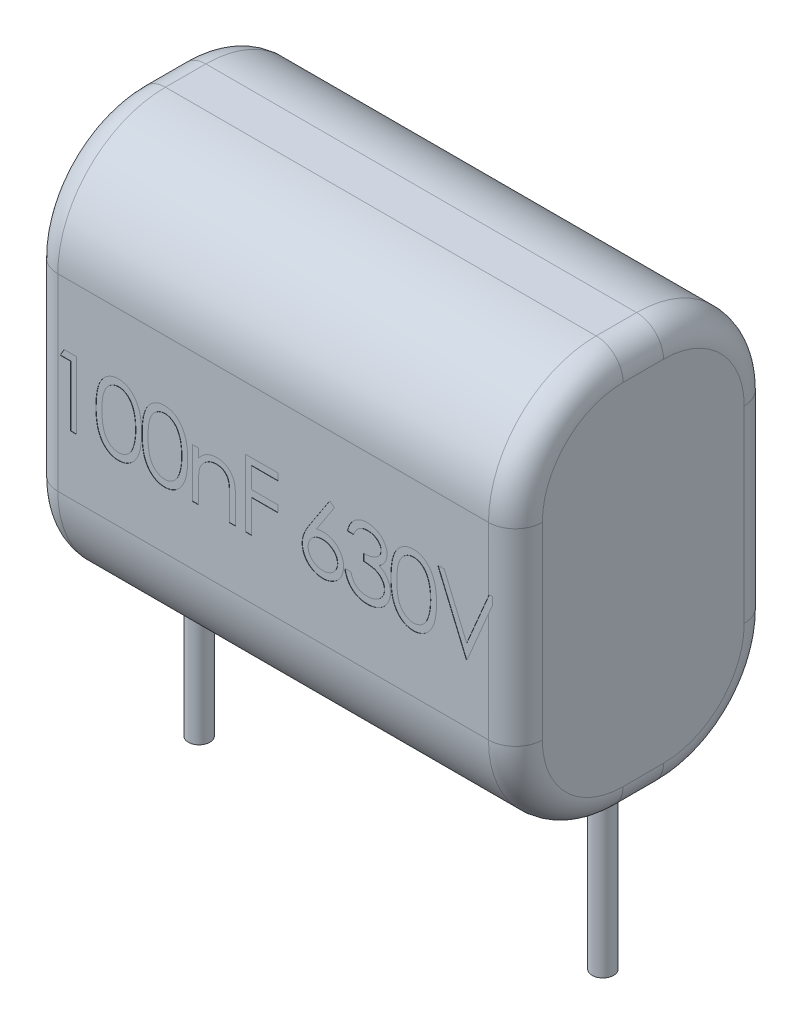
from build123d import *

# Parameters (mm, degrees)
BOSS_EXTRUDE1_DEPTH = 9
FILLET1_R           = 1
SKETCH2_R           = 0.4
BOSS_EXTRUDE2_DEPTH = 13.5
CUT_EXTRUDE1_DEPTH  = 0.01


with BuildPart() as part:
    # Sketch1 → Boss-Extrude1 (new, symmetric)
    with BuildSketch(Plane(origin=(0, 0, 0), x_dir=(0, 0, -1), z_dir=(1, 0, 0))):
        with BuildLine():
            Line((-0.75, 7.5), (0.75, 7.5))
            ThreePointArc((0.75, 7.5), (3.578427125, 6.328427125), (4.75, 3.5))
            Line((4.75, 3.5), (4.75, -3.5))
            ThreePointArc((4.75, -3.5), (3.578427125, -6.328427125), (0.75, -7.5))
            Line((0.75, -7.5), (-0.75, -7.5))
            ThreePointArc((-0.75, -7.5), (-3.578427125, -6.328427125), (-4.75, -3.5))
            Line((-4.75, -3.5), (-4.75, 3.5))
            ThreePointArc((-4.75, 3.5), (-3.578427125, 6.328427125), (-0.75, 7.5))
        make_face()
    extrude(amount=BOSS_EXTRUDE1_DEPTH, both=True)

    # Fillet1
    fillet1_edges = [part.edges().sort_by_distance(p)[0] for p in [
        (-9, 7.5, 0),
        (-9, 6.328427125, -3.578427125),
        (-9, 0, -4.75),
        (-9, -6.328427125, -3.578427125),
        (9, 6.328427125, -3.578427125),
        (9, 7.5, 0),
        (9, 6.328427125, 3.578427125),
        (9, 0, 4.75),
        (9, -6.328427125, 3.578427125),
        (9, -7.5, 0),
        (9, -6.328427125, -3.578427125),
        (-9, -7.5, 0),
        (9, 0, -4.75),
        (-9, -6.328427125, 3.578427125),
        (-9, 0, 4.75),
        (-9, 6.328427125, 3.578427125),
    ]]
    fillet(fillet1_edges, radius=FILLET1_R)

    # Sketch2 → Boss-Extrude2 (add)
    with BuildSketch(Plane(origin=(0, 0, 0), x_dir=(1, 0, 0), z_dir=(0, 1, 0))):
        with Locations(Location((7.5, 0, 0), (0, 0, 270))):
            Circle(SKETCH2_R)
        with Locations(Location((-7.5, 0, 0), (0, 0, 270))):
            Circle(SKETCH2_R)
    extrude(amount=-BOSS_EXTRUDE2_DEPTH)

    # Sketch4 → Cut-Extrude1 (cut)
    # profile 1 of 9: a face of its own
    with BuildSketch(Plane.XY.offset(4.75)):
        Polygon((-7.763521635, 1.179601095), (-7.301282051, 1.179601095), (-7.301282051, -1.320398905), (-7.525641026, -1.320398905), (-7.525641026, 0.923190838), (-7.91025641, 0.923190838), align=None)
    # profile 2 of 9: a face of its own
    with BuildSketch(Plane.XY.offset(4.75)):
        with BuildLine():
            add(Edge.make_bspline(
                [(-6.583333333, -0.071400508), (-6.583099035, -0.031330945), (-6.582643906, 0.046504758), (-6.577580748, 0.159922359), (-6.569169789, 0.266322566), (-6.557643095, 0.36571047), (-6.543615966, 0.45811173), (-6.524890618, 0.543279414), (-6.503595759, 0.621607705), (-6.478915441, 0.693352025), (-6.45106702, 0.759478956), (-6.420756834, 0.821211242), (-6.386781981, 0.87845548), (-6.351084186, 0.93212533), (-6.31221842, 0.981342255), (-6.271290713, 1.026801299), (-6.226703658, 1.067451836), (-6.179972938, 1.104484909), (-6.130675464, 1.136948817), (-6.080216416, 1.16554363), (-6.028248484, 1.189972107), (-5.974629782, 1.209179561), (-5.91984224, 1.225044452), (-5.863694335, 1.2358937), (-5.806093361, 1.242720063), (-5.767213765, 1.243372683), (-5.747495994, 1.243703659)],
                knots=[0, 0, 0, 0, 1.646270934, 3.197905019, 4.663502075, 6.030701355, 7.308322542, 8.50163776, 9.611534131, 10.641858119, 11.616356847, 12.558055219, 13.465016945, 14.349605745, 15.204443733, 16.039544428, 16.859896111, 17.680448484, 18.487036065, 19.28249412, 20.06191084, 20.843045899, 21.620316918, 22.403196591, 23.190181807, 24, 24, 24, 24], degree=3))
            add(Edge.make_bspline(
                [(-5.747495994, 1.243703659), (-5.727613509, 1.243355219), (-5.688073503, 1.242662283), (-5.629616092, 1.236002324), (-5.572509176, 1.224951522), (-5.51699622, 1.209293683), (-5.46262123, 1.1898682), (-5.40980951, 1.165520259), (-5.358233023, 1.137178211), (-5.308711389, 1.103875441), (-5.26070095, 1.066745244), (-5.215380976, 1.024771909), (-5.172747343, 0.978379252), (-5.132264982, 0.928063635), (-5.095082413, 0.872860003), (-5.059672818, 0.813728496), (-5.027978507, 0.749635021), (-4.997453739, 0.681648973), (-4.971105891, 0.607889217), (-4.947344288, 0.528771531), (-4.928145024, 0.443361397), (-4.912152687, 0.352106936), (-4.899763476, 0.25467302), (-4.89074016, 0.151268509), (-4.88597367, 0.041825372), (-4.885076027, -0.033001663), (-4.884615385, -0.071400508)],
                knots=[0, 0, 0, 0, 0.810914788, 1.612654377, 2.396697861, 3.181598691, 3.963628158, 4.749916497, 5.551656086, 6.361998678, 7.18212741, 8.025565596, 8.878627764, 9.750805457, 10.657531673, 11.591944965, 12.560506719, 13.57287815, 14.630710178, 15.753379473, 16.941251878, 18.199788006, 19.531962791, 20.947069417, 22.433333509, 24, 24, 24, 24], degree=3))
            add(Edge.make_bspline(
                [(-4.884615385, -0.071400508), (-4.885080802, -0.109631871), (-4.885987649, -0.184124122), (-4.890686725, -0.293074819), (-4.899942891, -0.395930564), (-4.911521454, -0.492938037), (-4.927557856, -0.583693479), (-4.947275832, -0.668510942), (-4.969168919, -0.747756708), (-4.996193772, -0.820781573), (-5.025772851, -0.888604232), (-5.057955134, -0.95193791), (-5.092433581, -1.011342404), (-5.129996971, -1.066342224), (-5.170035123, -1.117326979), (-5.213404972, -1.163396709), (-5.258883961, -1.205661475), (-5.307035687, -1.24326978), (-5.357329652, -1.276187498), (-5.408728993, -1.305625962), (-5.462145695, -1.329363602), (-5.516369233, -1.349745774), (-5.572175209, -1.365317525), (-5.629494059, -1.376084565), (-5.688034228, -1.383635885), (-5.727606774, -1.384211942), (-5.747495994, -1.384501469)],
                knots=[0, 0, 0, 0, 1.561518951, 3.042555995, 4.452378317, 5.7783523, 7.031515105, 8.214008947, 9.334062868, 10.386615937, 11.391082383, 12.354592575, 13.286541444, 14.194233754, 15.072674879, 15.931287219, 16.775624067, 17.606195743, 18.42308326, 19.229000347, 20.022332153, 20.807536673, 21.593273796, 22.3848459, 23.188221202, 24, 24, 24, 24], degree=3))
            add(Edge.make_bspline(
                [(-5.747495994, -1.384501469), (-5.767213218, -1.384168358), (-5.806091736, -1.383511528), (-5.863700611, -1.376716006), (-5.919616642, -1.365790646), (-5.974115752, -1.350493072), (-6.027477548, -1.331768189), (-6.078974896, -1.307372701), (-6.129180384, -1.279276937), (-6.177960067, -1.247280208), (-6.224397325, -1.210621862), (-6.268753472, -1.170075942), (-6.3099142, -1.124630648), (-6.348224268, -1.07500356), (-6.384634331, -1.021651244), (-6.418126741, -0.963845264), (-6.449105922, -0.901814828), (-6.477422701, -0.835159177), (-6.502528889, -0.762905657), (-6.524705824, -0.684227672), (-6.542215936, -0.59843079), (-6.557203761, -0.506204099), (-6.569292606, -0.407151291), (-6.577545696, -0.301218593), (-6.582646635, -0.188472015), (-6.583100257, -0.111136462), (-6.583333333, -0.071400508)],
                knots=[0, 0, 0, 0, 0.810891512, 1.598919785, 2.382837074, 3.152667961, 3.926044502, 4.706494248, 5.493654104, 6.291793342, 7.103789334, 7.925228297, 8.761435821, 9.622817696, 10.50288917, 11.416980706, 12.369136599, 13.353924996, 14.394355917, 15.514179734, 16.714354668, 17.994756427, 19.357759367, 20.818452758, 22.365282078, 24, 24, 24, 24], degree=3))
        make_face()
        with BuildLine():
            add(Edge.make_bspline(
                [(-6.358974359, -0.070398905), (-6.35888904, -0.103790833), (-6.358723452, -0.168598008), (-6.354397594, -0.262771766), (-6.348504571, -0.350607715), (-6.340903645, -0.432217384), (-6.329615824, -0.507324536), (-6.316968119, -0.576445738), (-6.301576626, -0.639215193), (-6.283365899, -0.696063629), (-6.262623687, -0.747955821), (-6.239976641, -0.796242403), (-6.215647554, -0.841493786), (-6.188419589, -0.883303506), (-6.158765972, -0.921807909), (-6.127356502, -0.957688504), (-6.093018941, -0.989686348), (-6.045516268, -1.028062673), (-5.982804501, -1.067719197), (-5.90378989, -1.102252118), (-5.822598139, -1.123953873), (-5.767490103, -1.126713698), (-5.739983974, -1.128091213)],
                knots=[0, 0, 0, 0, 1.459021318, 2.831673884, 4.118529203, 5.306027144, 6.411944654, 7.436330062, 8.375795394, 9.233974572, 10.042671642, 10.816086306, 11.563610507, 12.285937304, 12.993564865, 13.685989202, 14.367179055, 15.041617293, 16.353048772, 17.594441528, 18.799311195, 20, 20, 20, 20], degree=3))
            add(Edge.make_bspline(
                [(-5.739983974, -1.128091213), (-5.712299923, -1.126949941), (-5.656988978, -1.124669753), (-5.576179124, -1.102670655), (-5.497728931, -1.069478127), (-5.436248974, -1.030229909), (-5.389475729, -0.992852531), (-5.355963593, -0.960984925), (-5.325204987, -0.925302162), (-5.296032076, -0.886802665), (-5.269275594, -0.844750891), (-5.244944781, -0.799349051), (-5.22274239, -0.750471067), (-5.210093071, -0.716349825), (-5.203625801, -0.698904514)],
                knots=[0, 0, 0, 0, 1.353760809, 2.704726607, 4.075137775, 5.516104923, 6.260822281, 7.007110065, 7.778089737, 8.566572457, 9.372053459, 10.217411131, 11.088608312, 12, 12, 12, 12], degree=3))
            add(Edge.make_bspline(
                [(-5.203625801, -0.698904514), (-5.196088824, -0.676597557), (-5.180785529, -0.631304869), (-5.161062833, -0.561045117), (-5.145530405, -0.487328857), (-5.131556572, -0.410596631), (-5.122018675, -0.330282559), (-5.114341666, -0.246635142), (-5.109819746, -0.159591312), (-5.10925921, -0.100452032), (-5.108974359, -0.070398905)],
                knots=[0, 0, 0, 0, 0.884706709, 1.796334032, 2.740027952, 3.714592787, 4.726048262, 5.777819803, 6.87074269, 8, 8, 8, 8], degree=3))
            add(Edge.make_bspline(
                [(-5.108974359, -0.070398905), (-5.109367351, -0.040350639), (-5.110136128, 0.018430193), (-5.113074691, 0.104514608), (-5.120662958, 0.186277294), (-5.1290909, 0.264070489), (-5.141517487, 0.337463562), (-5.15491592, 0.407070923), (-5.172916786, 0.472030226), (-5.192145197, 0.533358499), (-5.214152622, 0.590358967), (-5.238378147, 0.643297385), (-5.264250832, 0.692429332), (-5.292352432, 0.737620004), (-5.322349349, 0.779071821), (-5.355033312, 0.815953674), (-5.389107864, 0.849408651), (-5.436834426, 0.8875962), (-5.499316061, 0.926533126), (-5.577062952, 0.962365811), (-5.657970555, 0.982943163), (-5.712665879, 0.985844368), (-5.739983974, 0.987293402)],
                knots=[0, 0, 0, 0, 1.31362396, 2.569729283, 3.763502607, 4.902122613, 5.988968491, 7.01645872, 7.998833611, 8.933434873, 9.825090667, 10.667526885, 11.477055099, 12.250526234, 12.991942729, 13.710640831, 14.402115721, 15.076753259, 16.378508321, 17.609869233, 18.806226677, 20, 20, 20, 20], degree=3))
            add(Edge.make_bspline(
                [(-5.739983974, 0.987293402), (-5.767634397, 0.985842369), (-5.822985616, 0.982937659), (-5.904734155, 0.962442478), (-5.983094406, 0.926718931), (-6.045410816, 0.887467236), (-6.093170664, 0.850082728), (-6.126801159, 0.817663832), (-6.158334139, 0.782202222), (-6.187382496, 0.743343711), (-6.214589127, 0.701582735), (-6.239575565, 0.65659076), (-6.262087943, 0.608139785), (-6.282862612, 0.556270903), (-6.301128889, 0.499427371), (-6.316196006, 0.436735233), (-6.330115329, 0.367833882), (-6.339969093, 0.292319947), (-6.348728918, 0.210689838), (-6.354358453, 0.122634611), (-6.358737922, 0.02830291), (-6.358893968, -0.036839346), (-6.358974359, -0.070398905)],
                knots=[0, 0, 0, 0, 1.207732386, 2.417664972, 3.655092373, 4.956220595, 5.625982001, 6.301752483, 6.994047911, 7.697131622, 8.419323945, 9.170223765, 9.943494443, 10.752040957, 11.610060368, 12.549350801, 13.567764191, 14.679664412, 15.874934091, 17.154273443, 18.533957287, 20, 20, 20, 20], degree=3))
        make_face(mode=Mode.SUBTRACT)
    # profile 3 of 9: a face of its own
    with BuildSketch(Plane.XY.offset(4.75)):
        with BuildLine():
            add(Edge.make_bspline(
                [(-4.871794872, -0.071400508), (-4.871560573, -0.031330945), (-4.871105445, 0.046504758), (-4.866042287, 0.159922359), (-4.857631328, 0.266322566), (-4.846104633, 0.36571047), (-4.832077504, 0.45811173), (-4.813352157, 0.543279414), (-4.792057298, 0.621607705), (-4.767376979, 0.693352025), (-4.739528559, 0.759478956), (-4.709218372, 0.821211242), (-4.675243519, 0.87845548), (-4.639545724, 0.93212533), (-4.600679959, 0.981342255), (-4.559752251, 1.026801299), (-4.515165197, 1.067451836), (-4.468434477, 1.104484909), (-4.419137002, 1.136948817), (-4.368677955, 1.16554363), (-4.316710022, 1.189972107), (-4.26309132, 1.209179561), (-4.208303779, 1.225044452), (-4.152155874, 1.2358937), (-4.0945549, 1.242720063), (-4.055675303, 1.243372683), (-4.035957532, 1.243703659)],
                knots=[0, 0, 0, 0, 1.646270934, 3.197905019, 4.663502075, 6.030701355, 7.308322542, 8.50163776, 9.611534131, 10.641858119, 11.616356847, 12.558055219, 13.465016945, 14.349605745, 15.204443733, 16.039544428, 16.859896111, 17.680448484, 18.487036065, 19.28249412, 20.06191084, 20.843045899, 21.620316918, 22.403196591, 23.190181807, 24, 24, 24, 24], degree=3))
            add(Edge.make_bspline(
                [(-4.035957532, 1.243703659), (-4.016075047, 1.243355219), (-3.976535041, 1.242662283), (-3.91807763, 1.236002324), (-3.860970715, 1.224951522), (-3.805457758, 1.209293683), (-3.751082768, 1.1898682), (-3.698271048, 1.165520259), (-3.646694561, 1.137178211), (-3.597172928, 1.103875441), (-3.549162488, 1.066745244), (-3.503842514, 1.024771909), (-3.461208882, 0.978379252), (-3.420726521, 0.928063635), (-3.383543951, 0.872860003), (-3.348134357, 0.813728496), (-3.316440045, 0.749635021), (-3.285915277, 0.681648973), (-3.25956743, 0.607889217), (-3.235805826, 0.528771531), (-3.216606563, 0.443361397), (-3.200614225, 0.352106936), (-3.188225014, 0.25467302), (-3.179201698, 0.151268509), (-3.174435209, 0.041825372), (-3.173537565, -0.033001663), (-3.173076923, -0.071400508)],
                knots=[0, 0, 0, 0, 0.810914788, 1.612654377, 2.396697861, 3.181598691, 3.963628158, 4.749916497, 5.551656086, 6.361998678, 7.18212741, 8.025565596, 8.878627764, 9.750805457, 10.657531673, 11.591944965, 12.560506719, 13.57287815, 14.630710178, 15.753379473, 16.941251878, 18.199788006, 19.531962791, 20.947069417, 22.433333509, 24, 24, 24, 24], degree=3))
            add(Edge.make_bspline(
                [(-3.173076923, -0.071400508), (-3.173542341, -0.109631871), (-3.174449188, -0.184124122), (-3.179148264, -0.293074819), (-3.188404429, -0.395930564), (-3.199982992, -0.492938037), (-3.216019394, -0.583693479), (-3.23573737, -0.668510942), (-3.257630458, -0.747756708), (-3.284655311, -0.820781573), (-3.31423439, -0.888604232), (-3.346416673, -0.95193791), (-3.38089512, -1.011342404), (-3.418458509, -1.066342224), (-3.458496661, -1.117326979), (-3.501866511, -1.163396709), (-3.5473455, -1.205661475), (-3.595497226, -1.24326978), (-3.645791191, -1.276187498), (-3.697190531, -1.305625962), (-3.750607234, -1.329363602), (-3.804830771, -1.349745774), (-3.860636747, -1.365317525), (-3.917955598, -1.376084565), (-3.976495766, -1.383635885), (-4.016068313, -1.384211942), (-4.035957532, -1.384501469)],
                knots=[0, 0, 0, 0, 1.561518951, 3.042555995, 4.452378317, 5.7783523, 7.031515105, 8.214008947, 9.334062868, 10.386615937, 11.391082383, 12.354592575, 13.286541444, 14.194233754, 15.072674879, 15.931287219, 16.775624067, 17.606195743, 18.42308326, 19.229000347, 20.022332153, 20.807536673, 21.593273796, 22.3848459, 23.188221202, 24, 24, 24, 24], degree=3))
            add(Edge.make_bspline(
                [(-4.035957532, -1.384501469), (-4.055674756, -1.384168358), (-4.094553274, -1.383511528), (-4.152162149, -1.376716006), (-4.20807818, -1.365790646), (-4.26257729, -1.350493072), (-4.315939087, -1.331768189), (-4.367436434, -1.307372701), (-4.417641923, -1.279276937), (-4.466421606, -1.247280208), (-4.512858864, -1.210621862), (-4.55721501, -1.170075942), (-4.598375738, -1.124630648), (-4.636685806, -1.07500356), (-4.673095869, -1.021651244), (-4.706588279, -0.963845264), (-4.73756746, -0.901814828), (-4.76588424, -0.835159177), (-4.790990428, -0.762905657), (-4.813167362, -0.684227672), (-4.830677475, -0.59843079), (-4.8456653, -0.506204099), (-4.857754145, -0.407151291), (-4.866007234, -0.301218593), (-4.871108174, -0.188472015), (-4.871561795, -0.111136462), (-4.871794872, -0.071400508)],
                knots=[0, 0, 0, 0, 0.810891512, 1.598919785, 2.382837074, 3.152667961, 3.926044502, 4.706494248, 5.493654104, 6.291793342, 7.103789334, 7.925228297, 8.761435821, 9.622817696, 10.50288917, 11.416980706, 12.369136599, 13.353924996, 14.394355917, 15.514179734, 16.714354668, 17.994756427, 19.357759367, 20.818452758, 22.365282078, 24, 24, 24, 24], degree=3))
        make_face()
        with BuildLine():
            add(Edge.make_bspline(
                [(-4.647435897, -0.070398905), (-4.647350578, -0.103790833), (-4.64718499, -0.168598008), (-4.642859132, -0.262771766), (-4.63696611, -0.350607715), (-4.629365183, -0.432217384), (-4.618077363, -0.507324536), (-4.605429657, -0.576445738), (-4.590038165, -0.639215193), (-4.571827437, -0.696063629), (-4.551085225, -0.747955821), (-4.52843818, -0.796242403), (-4.504109092, -0.841493786), (-4.476881127, -0.883303506), (-4.447227511, -0.921807909), (-4.41581804, -0.957688504), (-4.38148048, -0.989686348), (-4.333977807, -1.028062673), (-4.271266039, -1.067719197), (-4.192251428, -1.102252118), (-4.111059678, -1.123953873), (-4.055951642, -1.126713698), (-4.028445513, -1.128091213)],
                knots=[0, 0, 0, 0, 1.459021318, 2.831673884, 4.118529203, 5.306027144, 6.411944654, 7.436330062, 8.375795394, 9.233974572, 10.042671642, 10.816086306, 11.563610507, 12.285937304, 12.993564865, 13.685989202, 14.367179055, 15.041617293, 16.353048772, 17.594441528, 18.799311195, 20, 20, 20, 20], degree=3))
            add(Edge.make_bspline(
                [(-4.028445513, -1.128091213), (-4.000761462, -1.126949941), (-3.945450517, -1.124669753), (-3.864640663, -1.102670655), (-3.78619047, -1.069478127), (-3.724710513, -1.030229909), (-3.677937267, -0.992852531), (-3.644425131, -0.960984925), (-3.613666525, -0.925302162), (-3.584493615, -0.886802665), (-3.557737132, -0.844750891), (-3.53340632, -0.799349051), (-3.511203928, -0.750471067), (-3.49855461, -0.716349825), (-3.49208734, -0.698904514)],
                knots=[0, 0, 0, 0, 1.353760809, 2.704726607, 4.075137775, 5.516104923, 6.260822281, 7.007110065, 7.778089737, 8.566572457, 9.372053459, 10.217411131, 11.088608312, 12, 12, 12, 12], degree=3))
            add(Edge.make_bspline(
                [(-3.49208734, -0.698904514), (-3.484550363, -0.676597557), (-3.469247067, -0.631304869), (-3.449524371, -0.561045117), (-3.433991943, -0.487328857), (-3.420018111, -0.410596631), (-3.410480213, -0.330282559), (-3.402803204, -0.246635142), (-3.398281285, -0.159591312), (-3.397720748, -0.100452032), (-3.397435897, -0.070398905)],
                knots=[0, 0, 0, 0, 0.884706709, 1.796334032, 2.740027952, 3.714592787, 4.726048262, 5.777819803, 6.87074269, 8, 8, 8, 8], degree=3))
            add(Edge.make_bspline(
                [(-3.397435897, -0.070398905), (-3.39782889, -0.040350639), (-3.398597667, 0.018430193), (-3.401536229, 0.104514608), (-3.409124497, 0.186277294), (-3.417552439, 0.264070489), (-3.429979025, 0.337463562), (-3.443377459, 0.407070923), (-3.461378325, 0.472030226), (-3.480606735, 0.533358499), (-3.502614161, 0.590358967), (-3.526839685, 0.643297385), (-3.55271237, 0.692429332), (-3.580813971, 0.737620004), (-3.610810887, 0.779071821), (-3.643494851, 0.815953674), (-3.677569403, 0.849408651), (-3.725295964, 0.8875962), (-3.7877776, 0.926533126), (-3.865524491, 0.962365811), (-3.946432094, 0.982943163), (-4.001127418, 0.985844368), (-4.028445513, 0.987293402)],
                knots=[0, 0, 0, 0, 1.31362396, 2.569729283, 3.763502607, 4.902122613, 5.988968491, 7.01645872, 7.998833611, 8.933434873, 9.825090667, 10.667526885, 11.477055099, 12.250526234, 12.991942729, 13.710640831, 14.402115721, 15.076753259, 16.378508321, 17.609869233, 18.806226677, 20, 20, 20, 20], degree=3))
            add(Edge.make_bspline(
                [(-4.028445513, 0.987293402), (-4.056095936, 0.985842369), (-4.111447154, 0.982937659), (-4.193195693, 0.962442478), (-4.271555944, 0.926718931), (-4.333872355, 0.887467236), (-4.381632202, 0.850082728), (-4.415262698, 0.817663832), (-4.446795678, 0.782202222), (-4.475844035, 0.743343711), (-4.503050666, 0.701582735), (-4.528037103, 0.65659076), (-4.550549482, 0.608139785), (-4.57132415, 0.556270903), (-4.589590428, 0.499427371), (-4.604657544, 0.436735233), (-4.618576868, 0.367833882), (-4.628430631, 0.292319947), (-4.637190457, 0.210689838), (-4.642819991, 0.122634611), (-4.647199461, 0.02830291), (-4.647355507, -0.036839346), (-4.647435897, -0.070398905)],
                knots=[0, 0, 0, 0, 1.207732386, 2.417664972, 3.655092373, 4.956220595, 5.625982001, 6.301752483, 6.994047911, 7.697131622, 8.419323945, 9.170223765, 9.943494443, 10.752040957, 11.610060368, 12.549350801, 13.567764191, 14.679664412, 15.874934091, 17.154273443, 18.533957287, 20, 20, 20, 20], degree=3))
        make_face(mode=Mode.SUBTRACT)
    # profile 4 of 9: a face of its own
    with BuildSketch(Plane.XY.offset(4.75)):
        with BuildLine():
            Line((-3, 0.506524172), (-2.775641026, 0.506524172))
            Line((-2.775641026, 0.506524172), (-2.775641026, 0.176996928))
            add(Edge.make_bspline(
                [(-2.775641026, 0.176996928), (-2.751685572, 0.206884587), (-2.705199178, 0.264882633), (-2.627781797, 0.341111614), (-2.545964726, 0.403929632), (-2.460249009, 0.454003771), (-2.370518288, 0.491751361), (-2.277319523, 0.51901274), (-2.180094733, 0.535359046), (-2.113977278, 0.537494925), (-2.080528846, 0.538575454)],
                knots=[0, 0, 0, 0, 1.12780773, 2.188550248, 3.19190651, 4.159438251, 5.104880172, 6.052711206, 7.014878035, 8, 8, 8, 8], degree=3))
            add(Edge.make_bspline(
                [(-2.080528846, 0.538575454), (-2.04672125, 0.537328886), (-1.980551631, 0.534889051), (-1.884210158, 0.515591414), (-1.794229163, 0.482630518), (-1.71092948, 0.437479039), (-1.635838613, 0.381331558), (-1.569892291, 0.315918857), (-1.515347114, 0.240678797), (-1.478777569, 0.170876543), (-1.454687821, 0.108955976), (-1.439521865, 0.055922583), (-1.426642593, -0.003161811), (-1.415477059, -0.06811866), (-1.407921979, -0.139403082), (-1.401963199, -0.216722862), (-1.397692703, -0.300052955), (-1.39752327, -0.357686261), (-1.397435897, -0.387406117)],
                knots=[0, 0, 0, 0, 1.235846778, 2.418850247, 3.575807741, 4.728682307, 5.871620074, 6.994088408, 8.11269785, 9.256955736, 9.865816715, 10.540099792, 11.271859618, 12.076849838, 12.949306005, 13.892391288, 14.913166135, 16, 16, 16, 16], degree=3))
            Line((-1.397435897, -0.387406117), (-1.397435897, -1.320398905))
            Line((-1.397435897, -1.320398905), (-1.621794872, -1.320398905))
            Line((-1.621794872, -1.320398905), (-1.621794872, -0.461023905))
            add(Edge.make_bspline(
                [(-1.621794872, -0.461023905), (-1.621932878, -0.43615073), (-1.622196859, -0.38857258), (-1.623029464, -0.320451849), (-1.625036468, -0.258675721), (-1.627856692, -0.203391888), (-1.631984571, -0.154653433), (-1.63628645, -0.112361092), (-1.641547148, -0.076568562), (-1.646234943, -0.055022075), (-1.64833734, -0.045358841)],
                knots=[0, 0, 0, 0, 1.430800155, 2.736877192, 3.918605307, 4.986035426, 5.920637409, 6.731861385, 7.431261377, 8, 8, 8, 8], degree=3))
            add(Edge.make_bspline(
                [(-1.64833734, -0.045358841), (-1.655927005, -0.016993709), (-1.670534763, 0.037600394), (-1.706630465, 0.111653503), (-1.752212023, 0.174652209), (-1.807853344, 0.22620701), (-1.873016969, 0.266329036), (-1.947522071, 0.294167575), (-2.030649672, 0.311579196), (-2.089117088, 0.313312862), (-2.119591346, 0.314216479)],
                knots=[0, 0, 0, 0, 1.084156227, 2.086665306, 3.027808233, 3.945421172, 4.874247719, 5.839848303, 6.874090471, 8, 8, 8, 8], degree=3))
            add(Edge.make_bspline(
                [(-2.119591346, 0.314216479), (-2.137639692, 0.313876476), (-2.173356901, 0.313203618), (-2.226321167, 0.306452691), (-2.277695576, 0.295410937), (-2.327995725, 0.280504767), (-2.376215578, 0.260031718), (-2.423904357, 0.236796454), (-2.469266332, 0.207833445), (-2.513268758, 0.17555443), (-2.554206478, 0.139783567), (-2.592298148, 0.102037489), (-2.626253877, 0.061840629), (-2.657017216, 0.019840666), (-2.683573119, -0.024539218), (-2.706753896, -0.070870865), (-2.72642225, -0.119215257), (-2.736195601, -0.152768873), (-2.741085737, -0.169557559)],
                knots=[0, 0, 0, 0, 1.023777757, 2.026029729, 3.023749952, 4.003683103, 4.997618607, 5.993177895, 7.010360494, 8.046726602, 9.087585522, 10.09234134, 11.086953743, 12.070360549, 13.043493632, 14.017870808, 15.008233677, 16, 16, 16, 16], degree=3))
            add(Edge.make_bspline(
                [(-2.741085737, -0.169557559), (-2.743899772, -0.181882704), (-2.750025778, -0.2087139), (-2.756642335, -0.252745628), (-2.762647746, -0.303681325), (-2.767674145, -0.361461551), (-2.770749443, -0.426288605), (-2.774102583, -0.497885632), (-2.775323341, -0.576538124), (-2.775532165, -0.631296475), (-2.775641026, -0.659842014)],
                knots=[0, 0, 0, 0, 0.615963638, 1.340920617, 2.168419149, 3.115676021, 4.16674242, 5.331190069, 6.6087489, 8, 8, 8, 8], degree=3))
            Line((-2.775641026, -0.659842014), (-2.775641026, -1.320398905))
            Line((-2.775641026, -1.320398905), (-3, -1.320398905))
            Line((-3, -1.320398905), (-3, 0.506524172))
        make_face()
    # profile 5 of 9: a face of its own
    with BuildSketch(Plane.XY.offset(4.75)):
        Polygon((-1.032051282, 1.179601095), (0.185897436, 1.179601095), (0.185897436, 0.923190838), (-0.807692308, 0.923190838), (-0.807692308, 0.153960069), (0.185897436, 0.153960069), (0.185897436, -0.102450187), (-0.807692308, -0.102450187), (-0.807692308, -1.320398905), (-1.032051282, -1.320398905), align=None)
    # profile 6 of 9: a face of its own
    with BuildSketch(Plane.XY.offset(4.75)):
        with BuildLine():
            Line((2.102564103, 1.243703659), (2.275340545, 1.107986511))
            Line((2.275340545, 1.107986511), (1.614783654, 0.097870326))
            add(Edge.make_bspline(
                [(1.614783654, 0.097870326), (1.658762423, 0.104880226), (1.744547985, 0.118553829), (1.83138077, 0.120809505), (1.873697917, 0.121908787)],
                knots=[0, 0, 0, 0, 1.025318673, 2, 2, 2, 2], degree=3))
            add(Edge.make_bspline(
                [(1.873697917, 0.121908787), (1.899106843, 0.12122585), (1.949123557, 0.119881509), (2.022556987, 0.109535901), (2.093120513, 0.09323225), (2.160521665, 0.069466353), (2.225002366, 0.039107528), (2.286932649, 0.002722621), (2.34514837, -0.041567151), (2.400399213, -0.091042119), (2.450561425, -0.145839965), (2.494972893, -0.203983777), (2.532277745, -0.265412978), (2.562544832, -0.330096453), (2.586048316, -0.397934496), (2.603182348, -0.46884031), (2.613310629, -0.542862789), (2.614685979, -0.593204343), (2.615384615, -0.618776309)],
                knots=[0, 0, 0, 0, 1.04369286, 2.054478336, 3.041073146, 4.015093852, 4.984733326, 5.965804835, 6.960378782, 7.985147595, 9.009457201, 10.008161701, 10.986880575, 11.956520048, 12.937015923, 13.931873656, 14.949455224, 16, 16, 16, 16], degree=3))
            add(Edge.make_bspline(
                [(2.615384615, -0.618776309), (2.614368112, -0.653761812), (2.612367874, -0.722605002), (2.592436591, -0.822874078), (2.561465416, -0.918397303), (2.517195753, -1.007649569), (2.462208336, -1.090508547), (2.395152913, -1.163926736), (2.318407564, -1.229405334), (2.23163128, -1.284160062), (2.138243448, -1.328876527), (2.040134879, -1.360994558), (1.938258346, -1.380768464), (1.869112197, -1.383247466), (1.834134615, -1.384501469)],
                knots=[0, 0, 0, 0, 1.031375318, 2.029502543, 3.004789286, 3.987476834, 4.960371455, 5.9300674, 6.912260825, 7.929083631, 8.949397511, 9.960523116, 10.96833055, 12, 12, 12, 12], degree=3))
            add(Edge.make_bspline(
                [(1.834134615, -1.384501469), (1.800494115, -1.383409894), (1.733858173, -1.381247674), (1.635834749, -1.36198629), (1.541646879, -1.330766931), (1.451954465, -1.287756732), (1.368868312, -1.233429672), (1.294535715, -1.168028044), (1.229327305, -1.092949855), (1.175059718, -1.00820675), (1.132017767, -0.917142494), (1.099739249, -0.822187383), (1.080884789, -0.723687396), (1.078250106, -0.656915154), (1.076923077, -0.623283521)],
                knots=[0, 0, 0, 0, 1.012016664, 2.004627821, 2.994792927, 3.992885782, 4.990978636, 5.973936114, 6.964471063, 7.975201453, 8.993600317, 9.990122807, 10.98767138, 12, 12, 12, 12], degree=3))
            add(Edge.make_bspline(
                [(1.076923077, -0.623283521), (1.077766966, -0.59753739), (1.079490027, -0.54496871), (1.09152102, -0.465351547), (1.110853016, -0.383886489), (1.132503192, -0.31477635), (1.155378628, -0.258160977), (1.174416156, -0.212515627), (1.198111868, -0.165543432), (1.223378569, -0.115633692), (1.252490618, -0.064072669), (1.284144653, -0.009998619), (1.319215832, 0.045728472), (1.343801663, 0.083545755), (1.356370192, 0.102878338)],
                knots=[0, 0, 0, 0, 1.173818275, 2.396712641, 3.66331629, 4.989737886, 5.693666774, 6.447286557, 7.243889047, 8.091586357, 8.998013824, 9.943181721, 10.948533338, 12, 12, 12, 12], degree=3))
            Line((1.356370192, 0.102878338), (2.102564103, 1.243703659))
        make_face()
        with BuildLine():
            add(Edge.make_bspline(
                [(1.826622596, -0.134501469), (1.807578136, -0.135057215), (1.770378772, -0.136142747), (1.715802047, -0.142446499), (1.664149724, -0.15431726), (1.614737486, -0.169436068), (1.568489127, -0.190223968), (1.525068527, -0.215475253), (1.484307776, -0.245204666), (1.44663381, -0.278991031), (1.412476908, -0.315982483), (1.383061814, -0.35560357), (1.357688671, -0.39689943), (1.337058801, -0.440215103), (1.320994461, -0.485534031), (1.309374282, -0.532647781), (1.302907317, -0.581872285), (1.301831437, -0.615252644), (1.301282051, -0.632297944)],
                knots=[0, 0, 0, 0, 1.129588631, 2.206414736, 3.251139165, 4.268635594, 5.265702196, 6.250456724, 7.242448911, 8.251968645, 9.246821453, 10.222880186, 11.173611482, 12.116736599, 13.062300278, 14.020270554, 14.989073742, 16, 16, 16, 16], degree=3))
            add(Edge.make_bspline(
                [(1.301282051, -0.632297944), (1.301729452, -0.649190786), (1.302606739, -0.682315136), (1.310572682, -0.731128836), (1.322740598, -0.778103771), (1.340840881, -0.82299777), (1.362431515, -0.86649514), (1.390935318, -0.907020344), (1.422518737, -0.947034679), (1.460271546, -0.983464302), (1.500788234, -1.017361891), (1.544074807, -1.046990643), (1.589189064, -1.07233791), (1.63674008, -1.09220298), (1.686053211, -1.108506042), (1.737539321, -1.119978527), (1.791234218, -1.126464617), (1.827607031, -1.127541898), (1.846153846, -1.128091213)],
                knots=[0, 0, 0, 0, 0.989467248, 1.94019797, 2.891935182, 3.827694429, 4.772920941, 5.730924762, 6.725747692, 7.756678648, 8.79901574, 9.819492441, 10.826891316, 11.826466727, 12.835195252, 13.867842842, 14.912794438, 16, 16, 16, 16], degree=3))
            add(Edge.make_bspline(
                [(1.846153846, -1.128091213), (1.864700631, -1.127541855), (1.901073384, -1.126464489), (1.954768713, -1.119979011), (2.006253226, -1.108504263), (2.055572161, -1.092209427), (2.103101754, -1.072313992), (2.148176556, -1.047148335), (2.191053765, -1.017179679), (2.231597051, -0.98352223), (2.269192721, -0.946827336), (2.301533634, -0.907377534), (2.329164515, -0.866167609), (2.351617506, -0.823169116), (2.369518428, -0.778076625), (2.381748048, -0.731136108), (2.38969754, -0.682313232), (2.390577087, -0.649190143), (2.391025641, -0.632297944)],
                knots=[0, 0, 0, 0, 1.087397944, 2.132534446, 3.165364764, 4.174271784, 5.174024072, 6.181601208, 7.194203697, 8.236725232, 9.267838612, 10.269026844, 11.221737037, 12.171628256, 13.107553087, 14.05945871, 15.010357665, 16, 16, 16, 16], degree=3))
            add(Edge.make_bspline(
                [(2.391025641, -0.632297944), (2.390632575, -0.615230407), (2.389861113, -0.581732384), (2.381135435, -0.5326698), (2.36903374, -0.485294652), (2.350760147, -0.439904689), (2.327019757, -0.396679026), (2.298103038, -0.355399312), (2.264651202, -0.315749063), (2.226010102, -0.278918486), (2.18394565, -0.245242002), (2.139220232, -0.215513747), (2.092428822, -0.190424478), (2.043618863, -0.169490834), (1.99223109, -0.154384066), (1.939095133, -0.142488893), (1.883531388, -0.13615888), (1.845833811, -0.135060976), (1.826622596, -0.134501469)],
                knots=[0, 0, 0, 0, 0.978206639, 1.919901502, 2.851605144, 3.780102724, 4.718870031, 5.675451981, 6.667674623, 7.690630536, 8.733308323, 9.756129687, 10.767539656, 11.776269907, 12.797430371, 13.836405707, 14.897401972, 16, 16, 16, 16], degree=3))
        make_face(mode=Mode.SUBTRACT)
    # profile 7 of 9: a face of its own
    with BuildSketch(Plane.XY.offset(4.75)):
        with BuildLine():
            Line((2.980769231, 0.602678018), (2.756410256, 0.602678018))
            add(Edge.make_bspline(
                [(2.756410256, 0.602678018), (2.762488507, 0.627844078), (2.774370989, 0.677041667), (2.79915497, 0.747332567), (2.826154438, 0.813849368), (2.858575227, 0.875346564), (2.893938623, 0.933060066), (2.934454853, 0.985680869), (2.978254655, 1.034547273), (3.026701047, 1.077913871), (3.077507234, 1.117183678), (3.131389105, 1.150665861), (3.187262601, 1.179468828), (3.245514839, 1.203197565), (3.306319247, 1.221072939), (3.369126121, 1.234042086), (3.434100049, 1.24246431), (3.478205471, 1.243286284), (3.500600962, 1.243703659)],
                knots=[0, 0, 0, 0, 1.162005537, 2.271625781, 3.343758855, 4.383309926, 5.390229558, 6.379919256, 7.361854164, 8.333198761, 9.295911338, 10.242430842, 11.177959212, 12.116337295, 13.062827104, 14.020064771, 14.994644689, 16, 16, 16, 16], degree=3))
            add(Edge.make_bspline(
                [(3.500600962, 1.243703659), (3.533231492, 1.242718494), (3.597780785, 1.240769655), (3.692611533, 1.222973629), (3.784059261, 1.19481282), (3.871123009, 1.155903015), (3.951993318, 1.107912077), (4.023947737, 1.050794408), (4.086010959, 0.985652049), (4.138078372, 0.913700218), (4.178846229, 0.836803425), (4.208907924, 0.757660456), (4.227209125, 0.676459048), (4.229580951, 0.62163242), (4.230769231, 0.594164396)],
                knots=[0, 0, 0, 0, 1.083050992, 2.142477498, 3.193116406, 4.255571735, 5.30263384, 6.308962982, 7.297363603, 8.282367274, 9.249857812, 10.179914175, 11.08814088, 12, 12, 12, 12], degree=3))
            add(Edge.make_bspline(
                [(4.230769231, 0.594164396), (4.229938094, 0.567730971), (4.228311689, 0.516004861), (4.2145019, 0.440489506), (4.191261712, 0.369316934), (4.159069024, 0.302187533), (4.117396488, 0.239526933), (4.066915991, 0.181194154), (4.007271232, 0.126930469), (3.962071991, 0.095845131), (3.938802083, 0.079841479)],
                knots=[0, 0, 0, 0, 1.024540389, 2.004866551, 2.965041327, 3.920577974, 4.882998113, 5.874504559, 6.905732034, 8, 8, 8, 8], degree=3))
            add(Edge.make_bspline(
                [(3.938802083, 0.079841479), (3.965396194, 0.066999928), (4.018086818, 0.041557101), (4.089908625, -0.008339868), (4.155107107, -0.065951545), (4.191466907, -0.110910583), (4.209735577, -0.133499867)],
                knots=[0, 0, 0, 0, 1.015518401, 2.012035669, 3.001164323, 4, 4, 4, 4], degree=3))
            add(Edge.make_bspline(
                [(4.209735577, -0.133499867), (4.221765107, -0.149969689), (4.245627176, -0.18263963), (4.275081128, -0.235165648), (4.301801924, -0.288273855), (4.32262351, -0.343387716), (4.3387477, -0.39986844), (4.350273438, -0.457813009), (4.357433538, -0.517268739), (4.358458932, -0.557491939), (4.358974359, -0.577710604)],
                knots=[0, 0, 0, 0, 1.025084078, 2.033381695, 3.024893161, 4.013698104, 4.991890475, 5.976764909, 6.982997093, 8, 8, 8, 8], degree=3))
            add(Edge.make_bspline(
                [(4.358974359, -0.577710604), (4.357692564, -0.612717548), (4.355135005, -0.682566692), (4.332274952, -0.785762922), (4.296836923, -0.88663828), (4.24651054, -0.983120308), (4.185176605, -1.073392009), (4.112207088, -1.154160801), (4.028431082, -1.223588376), (3.934998476, -1.281595682), (3.833771955, -1.327965626), (3.725503675, -1.360149514), (3.611753637, -1.381110942), (3.533748424, -1.383358706), (3.494090545, -1.384501469)],
                knots=[0, 0, 0, 0, 0.955779014, 1.907060117, 2.875433937, 3.871313158, 4.872415639, 5.851225146, 6.836215519, 7.83643374, 8.849228613, 9.86973379, 10.916971861, 12, 12, 12, 12], degree=3))
            add(Edge.make_bspline(
                [(3.494090545, -1.384501469), (3.467362473, -1.383881317), (3.414770541, -1.382661064), (3.337453756, -1.374319206), (3.263652543, -1.359083488), (3.193267116, -1.338581127), (3.126234947, -1.312587026), (3.062760586, -1.280216527), (3.002453519, -1.242136883), (2.94588284, -1.197898606), (2.893055291, -1.148411934), (2.845374774, -1.092798356), (2.802046351, -1.032085924), (2.76423018, -0.965569456), (2.730203785, -0.894108558), (2.702217388, -0.816788202), (2.677584839, -0.734299615), (2.666132364, -0.676815514), (2.66025641, -0.647321982)],
                knots=[0, 0, 0, 0, 1.048658725, 2.063410685, 3.046034179, 4.001477787, 4.936774919, 5.862367409, 6.792675028, 7.730719943, 8.675894397, 9.627829632, 10.600096036, 11.597688215, 12.626045268, 13.701542398, 14.82072376, 16, 16, 16, 16], degree=3))
            Line((2.66025641, -0.647321982), (2.884615385, -0.647321982))
            add(Edge.make_bspline(
                [(2.884615385, -0.647321982), (2.890460593, -0.666571277), (2.90183003, -0.704012829), (2.9211831, -0.757898761), (2.943231866, -0.807297371), (2.966885122, -0.852571029), (2.99172687, -0.894165602), (3.019523245, -0.930981223), (3.048215491, -0.964634939), (3.069843601, -0.983595376), (3.080428686, -0.992874867)],
                knots=[0, 0, 0, 0, 1.198163088, 2.33053128, 3.407730985, 4.417276592, 5.372219308, 6.28897303, 7.162600585, 8, 8, 8, 8], degree=3))
            add(Edge.make_bspline(
                [(3.080428686, -0.992874867), (3.094426241, -1.003666534), (3.122378143, -1.025216557), (3.167926879, -1.05271772), (3.215830369, -1.076547024), (3.267126565, -1.094749663), (3.320708544, -1.110162278), (3.377442376, -1.120248363), (3.436827531, -1.127168486), (3.477375934, -1.127779151), (3.498096955, -1.128091213)],
                knots=[0, 0, 0, 0, 0.946170439, 1.889420265, 2.845303464, 3.807233317, 4.801018734, 5.828864929, 6.890507805, 8, 8, 8, 8], degree=3))
            add(Edge.make_bspline(
                [(3.498096955, -1.128091213), (3.521492314, -1.127651281), (3.567239919, -1.126791031), (3.63399339, -1.118879812), (3.69749871, -1.107358088), (3.7570508, -1.0895631), (3.813429733, -1.067576778), (3.865845197, -1.039970774), (3.914985273, -1.007581687), (3.960220563, -0.970768002), (4.000895925, -0.930466934), (4.036709863, -0.888314741), (4.06715605, -0.844489148), (4.091715749, -0.798747633), (4.111108999, -0.751279613), (4.124311285, -0.701951877), (4.133490939, -0.651168116), (4.134238519, -0.616647424), (4.134615385, -0.599245059)],
                knots=[0, 0, 0, 0, 1.217147791, 2.380027433, 3.494444702, 4.572153297, 5.609568379, 6.639424714, 7.649109417, 8.668170816, 9.669597737, 10.625200337, 11.543417969, 12.441394052, 13.322311151, 14.205496177, 15.095365482, 16, 16, 16, 16], degree=3))
            add(Edge.make_bspline(
                [(4.134615385, -0.599245059), (4.133522312, -0.575951246), (4.131341606, -0.529479525), (4.114692621, -0.46110983), (4.087307718, -0.395235964), (4.04897021, -0.332981828), (4.002301832, -0.275284755), (3.94775547, -0.223805125), (3.884878164, -0.181326488), (3.827006829, -0.151977448), (3.775746003, -0.131950966), (3.731877871, -0.118611706), (3.682766012, -0.107316237), (3.629004334, -0.096807472), (3.570187751, -0.087863652), (3.506380295, -0.080405212), (3.437569037, -0.074437325), (3.38993249, -0.071772257), (3.365384615, -0.070398905)],
                knots=[0, 0, 0, 0, 1.07054697, 2.135767047, 3.216561865, 4.33974944, 5.486079747, 6.621378074, 7.775625952, 8.963672916, 9.598146892, 10.304877434, 11.070270905, 11.915000392, 12.823868403, 13.805723172, 14.86925407, 16, 16, 16, 16], degree=3))
            Line((3.365384615, -0.070398905), (3.365384615, 0.186011351))
            add(Edge.make_bspline(
                [(3.365384615, 0.186011351), (3.396314019, 0.186536211), (3.456897124, 0.187564282), (3.545393056, 0.199998576), (3.630016851, 0.217199024), (3.708893095, 0.24354559), (3.780785033, 0.274145802), (3.843156177, 0.309754523), (3.895132711, 0.349336487), (3.936462048, 0.393502636), (3.967554354, 0.440870527), (3.990287781, 0.490239569), (4.003716585, 0.542042469), (4.005509204, 0.577395804), (4.006410256, 0.595165999)],
                knots=[0, 0, 0, 0, 1.321986639, 2.589447074, 3.816329219, 5.01088745, 6.139805852, 7.153945165, 8.075214402, 8.924034688, 9.728124013, 10.488707548, 11.240355623, 12, 12, 12, 12], degree=3))
            add(Edge.make_bspline(
                [(4.006410256, 0.595165999), (4.006114249, 0.608221531), (4.005525355, 0.634194893), (3.998098728, 0.672141371), (3.986938699, 0.708927761), (3.971596035, 0.744397625), (3.951060179, 0.778304964), (3.926484474, 0.810938856), (3.897221545, 0.842112984), (3.863689083, 0.871170355), (3.827680651, 0.898862667), (3.788216526, 0.922372408), (3.746486616, 0.942476023), (3.702444719, 0.959054239), (3.655947912, 0.971525159), (3.607214656, 0.980479332), (3.556152025, 0.986077657), (3.521315074, 0.986883668), (3.503605769, 0.987293402)],
                knots=[0, 0, 0, 0, 0.884392785, 1.759457502, 2.611959086, 3.489218968, 4.37281399, 5.2945488, 6.255912374, 7.266815255, 8.301784654, 9.332968512, 10.37626691, 11.440494194, 12.520033166, 13.637162961, 14.798855837, 16, 16, 16, 16], degree=3))
            add(Edge.make_bspline(
                [(3.503605769, 0.987293402), (3.475140292, 0.986299572), (3.419540595, 0.984358391), (3.339387083, 0.967356239), (3.264873273, 0.940229036), (3.207917082, 0.907848308), (3.165858101, 0.875883713), (3.135803145, 0.847967722), (3.106288494, 0.816944277), (3.079255868, 0.78090258), (3.051917313, 0.742283444), (3.027028341, 0.699123672), (3.002842846, 0.652549104), (2.988269597, 0.619623651), (2.980769231, 0.602678018)],
                knots=[0, 0, 0, 0, 1.472543308, 2.876219568, 4.221790263, 5.565193594, 6.249813518, 6.953379497, 7.687249741, 8.463570142, 9.283606569, 10.136032583, 11.040678096, 12, 12, 12, 12], degree=3))
        make_face()
    # profile 8 of 9: a face of its own
    with BuildSketch(Plane.XY.offset(4.75)):
        with BuildLine():
            add(Edge.make_bspline(
                [(4.371794872, -0.071400508), (4.37202917, -0.031330945), (4.372484299, 0.046504758), (4.377547457, 0.159922359), (4.385958416, 0.266322566), (4.397485111, 0.36571047), (4.411512239, 0.45811173), (4.430237587, 0.543279414), (4.451532446, 0.621607705), (4.476212764, 0.693352025), (4.504061185, 0.759478956), (4.534371371, 0.821211242), (4.568346224, 0.87845548), (4.604044019, 0.93212533), (4.642909785, 0.981342255), (4.683837492, 1.026801299), (4.728424547, 1.067451836), (4.775155267, 1.104484909), (4.824452742, 1.136948817), (4.874911789, 1.16554363), (4.926879722, 1.189972107), (4.980498424, 1.209179561), (5.035285965, 1.225044452), (5.09143387, 1.2358937), (5.149034844, 1.242720063), (5.18791444, 1.243372683), (5.207632212, 1.243703659)],
                knots=[0, 0, 0, 0, 1.646270934, 3.197905019, 4.663502075, 6.030701355, 7.308322542, 8.50163776, 9.611534131, 10.641858119, 11.616356847, 12.558055219, 13.465016945, 14.349605745, 15.204443733, 16.039544428, 16.859896111, 17.680448484, 18.487036065, 19.28249412, 20.06191084, 20.843045899, 21.620316918, 22.403196591, 23.190181807, 24, 24, 24, 24], degree=3))
            add(Edge.make_bspline(
                [(5.207632212, 1.243703659), (5.227514696, 1.243355219), (5.267054703, 1.242662283), (5.325512113, 1.236002324), (5.382619029, 1.224951522), (5.438131985, 1.209293683), (5.492506975, 1.1898682), (5.545318695, 1.165520259), (5.596895182, 1.137178211), (5.646416816, 1.103875441), (5.694427256, 1.066745244), (5.739747229, 1.024771909), (5.782380862, 0.978379252), (5.822863223, 0.928063635), (5.860045792, 0.872860003), (5.895455387, 0.813728496), (5.927149698, 0.749635021), (5.957674466, 0.681648973), (5.984022314, 0.607889217), (6.007783918, 0.528771531), (6.026983181, 0.443361397), (6.042975518, 0.352106936), (6.05536473, 0.25467302), (6.064388045, 0.151268509), (6.069154535, 0.041825372), (6.070052178, -0.033001663), (6.070512821, -0.071400508)],
                knots=[0, 0, 0, 0, 0.810914788, 1.612654377, 2.396697861, 3.181598691, 3.963628158, 4.749916497, 5.551656086, 6.361998678, 7.18212741, 8.025565596, 8.878627764, 9.750805457, 10.657531673, 11.591944965, 12.560506719, 13.57287815, 14.630710178, 15.753379473, 16.941251878, 18.199788006, 19.531962791, 20.947069417, 22.433333509, 24, 24, 24, 24], degree=3))
            add(Edge.make_bspline(
                [(6.070512821, -0.071400508), (6.070047403, -0.109631871), (6.069140556, -0.184124122), (6.06444148, -0.293074819), (6.055185315, -0.395930564), (6.043606751, -0.492938037), (6.027570349, -0.583693479), (6.007852373, -0.668510942), (5.985959286, -0.747756708), (5.958934433, -0.820781573), (5.929355354, -0.888604232), (5.897173071, -0.95193791), (5.862694624, -1.011342404), (5.825131234, -1.066342224), (5.785093082, -1.117326979), (5.741723233, -1.163396709), (5.696244244, -1.205661475), (5.648092518, -1.24326978), (5.597798553, -1.276187498), (5.546399212, -1.305625962), (5.49298251, -1.329363602), (5.438758972, -1.349745774), (5.382952996, -1.365317525), (5.325634146, -1.376084565), (5.267093977, -1.383635885), (5.227521431, -1.384211942), (5.207632212, -1.384501469)],
                knots=[0, 0, 0, 0, 1.561518951, 3.042555995, 4.452378317, 5.7783523, 7.031515105, 8.214008947, 9.334062868, 10.386615937, 11.391082383, 12.354592575, 13.286541444, 14.194233754, 15.072674879, 15.931287219, 16.775624067, 17.606195743, 18.42308326, 19.229000347, 20.022332153, 20.807536673, 21.593273796, 22.3848459, 23.188221202, 24, 24, 24, 24], degree=3))
            add(Edge.make_bspline(
                [(5.207632212, -1.384501469), (5.187914987, -1.384168358), (5.14903647, -1.383511528), (5.091427594, -1.376716006), (5.035511563, -1.365790646), (4.981012453, -1.350493072), (4.927650657, -1.331768189), (4.876153309, -1.307372701), (4.825947821, -1.279276937), (4.777168138, -1.247280208), (4.73073088, -1.210621862), (4.686374733, -1.170075942), (4.645214005, -1.124630648), (4.606903937, -1.07500356), (4.570493874, -1.021651244), (4.537001465, -0.963845264), (4.506022283, -0.901814828), (4.477705504, -0.835159177), (4.452599316, -0.762905657), (4.430422381, -0.684227672), (4.412912269, -0.59843079), (4.397924444, -0.506204099), (4.385835599, -0.407151291), (4.377582509, -0.301218593), (4.37248157, -0.188472015), (4.372027948, -0.111136462), (4.371794872, -0.071400508)],
                knots=[0, 0, 0, 0, 0.810891512, 1.598919785, 2.382837074, 3.152667961, 3.926044502, 4.706494248, 5.493654104, 6.291793342, 7.103789334, 7.925228297, 8.761435821, 9.622817696, 10.50288917, 11.416980706, 12.369136599, 13.353924996, 14.394355917, 15.514179734, 16.714354668, 17.994756427, 19.357759367, 20.818452758, 22.365282078, 24, 24, 24, 24], degree=3))
        make_face()
        with BuildLine():
            add(Edge.make_bspline(
                [(4.596153846, -0.070398905), (4.596239165, -0.103790833), (4.596404754, -0.168598008), (4.600730611, -0.262771766), (4.606623634, -0.350607715), (4.614224561, -0.432217384), (4.625512381, -0.507324536), (4.638160086, -0.576445738), (4.653551579, -0.639215193), (4.671762306, -0.696063629), (4.692504518, -0.747955821), (4.715151564, -0.796242403), (4.739480651, -0.841493786), (4.766708616, -0.883303506), (4.796362233, -0.921807909), (4.827771704, -0.957688504), (4.862109264, -0.989686348), (4.909611937, -1.028062673), (4.972323704, -1.067719197), (5.051338315, -1.102252118), (5.132530066, -1.123953873), (5.187638102, -1.126713698), (5.215144231, -1.128091213)],
                knots=[0, 0, 0, 0, 1.459021318, 2.831673884, 4.118529203, 5.306027144, 6.411944654, 7.436330062, 8.375795394, 9.233974572, 10.042671642, 10.816086306, 11.563610507, 12.285937304, 12.993564865, 13.685989202, 14.367179055, 15.041617293, 16.353048772, 17.594441528, 18.799311195, 20, 20, 20, 20], degree=3))
            add(Edge.make_bspline(
                [(5.215144231, -1.128091213), (5.242828282, -1.126949941), (5.298139227, -1.124669753), (5.378949081, -1.102670655), (5.457399274, -1.069478127), (5.518879231, -1.030229909), (5.565652476, -0.992852531), (5.599164612, -0.960984925), (5.629923218, -0.925302162), (5.659096129, -0.886802665), (5.685852611, -0.844750891), (5.710183424, -0.799349051), (5.732385815, -0.750471067), (5.745035134, -0.716349825), (5.751502404, -0.698904514)],
                knots=[0, 0, 0, 0, 1.353760809, 2.704726607, 4.075137775, 5.516104923, 6.260822281, 7.007110065, 7.778089737, 8.566572457, 9.372053459, 10.217411131, 11.088608312, 12, 12, 12, 12], degree=3))
            add(Edge.make_bspline(
                [(5.751502404, -0.698904514), (5.759039381, -0.676597557), (5.774342676, -0.631304869), (5.794065372, -0.561045117), (5.8095978, -0.487328857), (5.823571633, -0.410596631), (5.83310953, -0.330282559), (5.84078654, -0.246635142), (5.845308459, -0.159591312), (5.845868995, -0.100452032), (5.846153846, -0.070398905)],
                knots=[0, 0, 0, 0, 0.884706709, 1.796334032, 2.740027952, 3.714592787, 4.726048262, 5.777819803, 6.87074269, 8, 8, 8, 8], degree=3))
            add(Edge.make_bspline(
                [(5.846153846, -0.070398905), (5.845760854, -0.040350639), (5.844992077, 0.018430193), (5.842053514, 0.104514608), (5.834465247, 0.186277294), (5.826037305, 0.264070489), (5.813610718, 0.337463562), (5.800212285, 0.407070923), (5.782211419, 0.472030226), (5.762983008, 0.533358499), (5.740975583, 0.590358967), (5.716750058, 0.643297385), (5.690877373, 0.692429332), (5.662775773, 0.737620004), (5.632778857, 0.779071821), (5.600094893, 0.815953674), (5.566020341, 0.849408651), (5.51829378, 0.8875962), (5.455812144, 0.926533126), (5.378065253, 0.962365811), (5.29715765, 0.982943163), (5.242462326, 0.985844368), (5.215144231, 0.987293402)],
                knots=[0, 0, 0, 0, 1.31362396, 2.569729283, 3.763502607, 4.902122613, 5.988968491, 7.01645872, 7.998833611, 8.933434873, 9.825090667, 10.667526885, 11.477055099, 12.250526234, 12.991942729, 13.710640831, 14.402115721, 15.076753259, 16.378508321, 17.609869233, 18.806226677, 20, 20, 20, 20], degree=3))
            add(Edge.make_bspline(
                [(5.215144231, 0.987293402), (5.187493808, 0.985842369), (5.13214259, 0.982937659), (5.05039405, 0.962442478), (4.972033799, 0.926718931), (4.909717389, 0.887467236), (4.861957541, 0.850082728), (4.828327046, 0.817663832), (4.796794066, 0.782202222), (4.767745709, 0.743343711), (4.740539078, 0.701582735), (4.71555264, 0.65659076), (4.693040262, 0.608139785), (4.672265593, 0.556270903), (4.653999316, 0.499427371), (4.638932199, 0.436735233), (4.625012876, 0.367833882), (4.615159112, 0.292319947), (4.606399287, 0.210689838), (4.600769752, 0.122634611), (4.596390283, 0.02830291), (4.596234237, -0.036839346), (4.596153846, -0.070398905)],
                knots=[0, 0, 0, 0, 1.207732386, 2.417664972, 3.655092373, 4.956220595, 5.625982001, 6.301752483, 6.994047911, 7.697131622, 8.419323945, 9.170223765, 9.943494443, 10.752040957, 11.610060368, 12.549350801, 13.567764191, 14.679664412, 15.874934091, 17.154273443, 18.533957287, 20, 20, 20, 20], degree=3))
        make_face(mode=Mode.SUBTRACT)
    # profile 9 of 9: a face of its own
    with BuildSketch(Plane.XY.offset(4.75)):
        Polygon((6.115384615, 1.179601095), (6.355769231, 1.179601095), (7.189102564, -0.790551149), (8.022435897, 1.179601095), (8.262820513, 1.179601095), (7.205128205, -1.320398905), (7.173076923, -1.320398905), align=None)
    extrude(amount=-CUT_EXTRUDE1_DEPTH, mode=Mode.SUBTRACT)


solid = part.part
